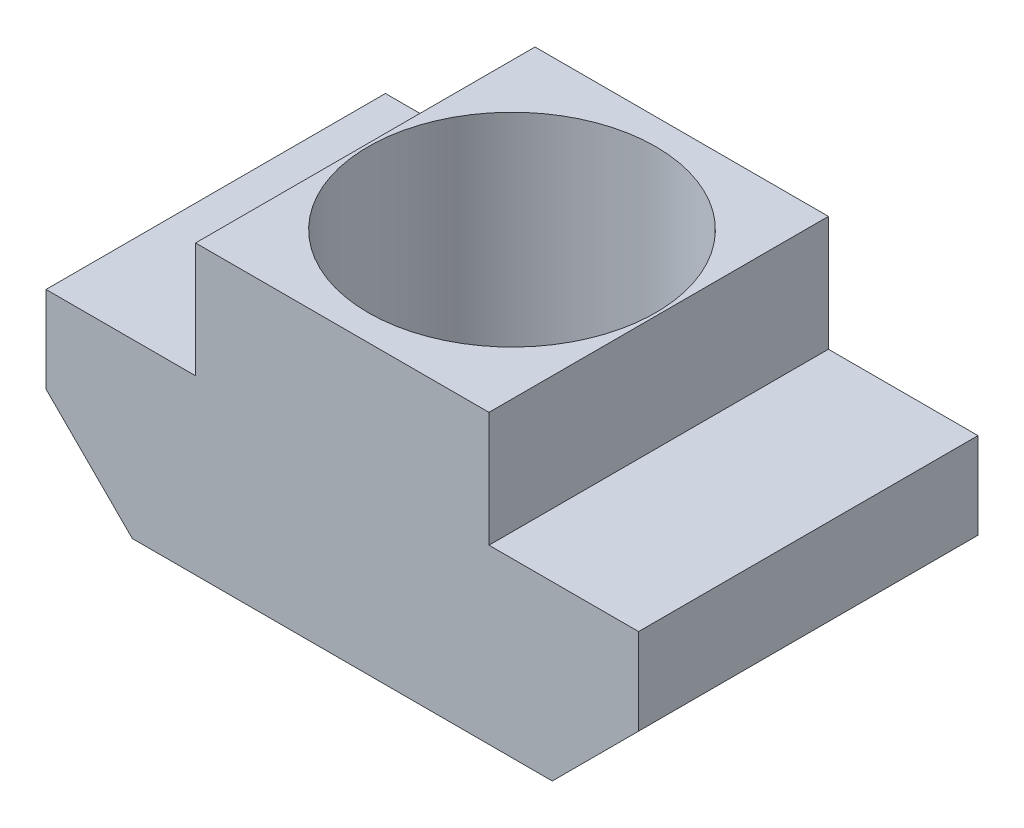
from build123d import *

# Parameters (mm, degrees)
SKETCH_1_W          = 2.6
SKETCH_1_H          = 5.9
EXTRUDE_3_DEPTH     = 3
EXTRUDE_3_2_DEPTH   = 3
SKETCH_1_3_W        = 5.1
SKETCH_1_3_H        = 5.9
SKETCH_1_3_R        = 2.5
EXTRUDE_4_DEPTH     = 5
CUT_EXTRUDE_1_DEPTH = 10.2915284


with BuildPart() as part:
    # 草图1 → 凸台-拉伸3 (new body)
    with BuildSketch(Plane(origin=(0, 0, 0), x_dir=(1, 0, 0), z_dir=(0, 1, 0))):
        with Locations((3.85, 0)):
            Rectangle(SKETCH_1_W, SKETCH_1_H)
    extrude(amount=EXTRUDE_3_DEPTH)



with BuildPart() as body_2:
    # 草图1 → Extrude 3 2 (new body)
    with BuildSketch(Plane(origin=(0, 0, 0), x_dir=(1, 0, 0), z_dir=(0, 1, 0))):
        with Locations((-3.85, 0)):
            Rectangle(SKETCH_1_W, SKETCH_1_H)
    extrude(amount=EXTRUDE_3_2_DEPTH)


with BuildPart() as part_1:
    add(part.part)

    add(body_2.part)  # 凸台-拉伸4 merges body 2
    # 草图1<3> → 凸台-拉伸4 (add)
    with BuildSketch(Plane(origin=(0, 0, 0), x_dir=(1, 0, 0), z_dir=(0, 1, 0))):
        Rectangle(SKETCH_1_3_W, SKETCH_1_3_H)
        Circle(SKETCH_1_3_R, mode=Mode.SUBTRACT)
    extrude(amount=EXTRUDE_4_DEPTH)

    # 草图2 → 切除-拉伸1 (cut, through all)
    with BuildSketch(Plane.XY.offset(2.95)):
        Polygon((-5.15, 1.5), (-3.65, 0), (-5.15, 0), align=None)
        Polygon((5.15, 1.5), (3.65, 0), (5.15, 0), align=None)
    extrude(amount=-CUT_EXTRUDE_1_DEPTH, mode=Mode.SUBTRACT)


solid = part_1.part
